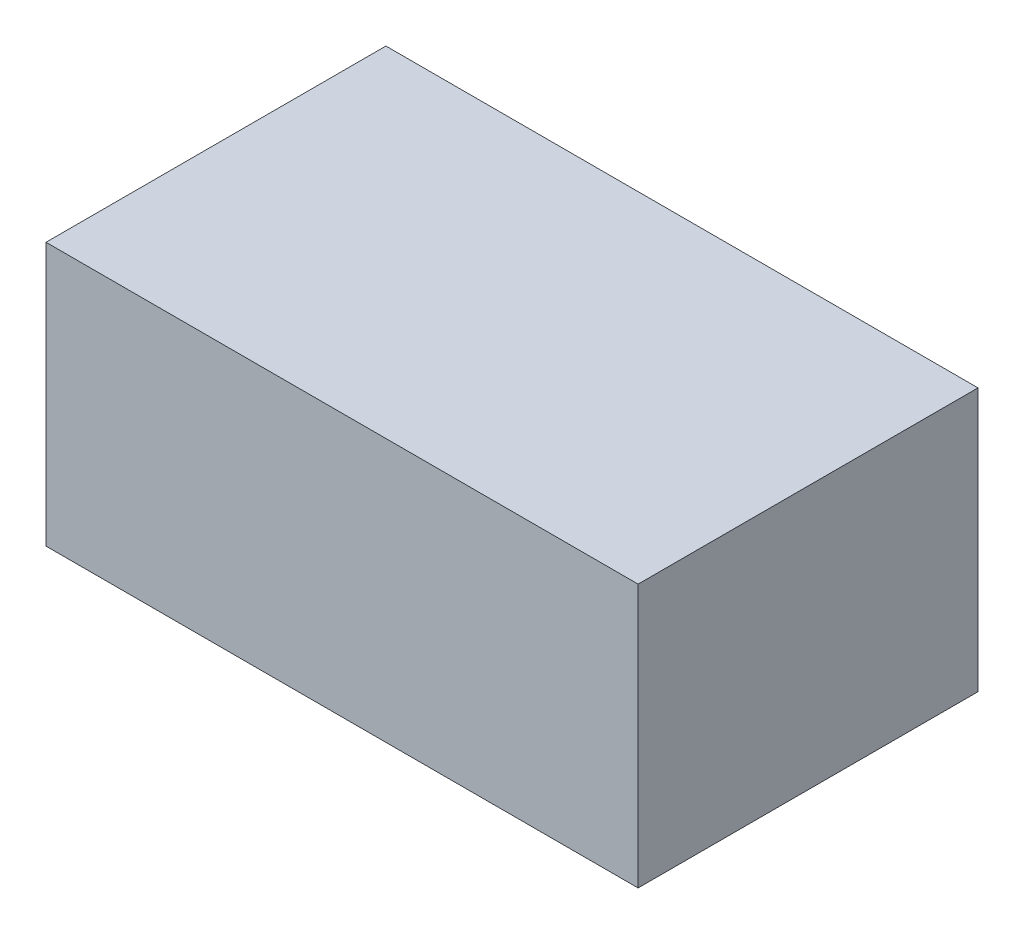
from build123d import *

# Parameters (mm, degrees)
SKETCH1_W           = 685.8
SKETCH1_H           = 393.7
BOSS_EXTRUDE1_DEPTH = 304.8


with BuildPart() as part:
    # Sketch1 → Boss-Extrude1 (new body)
    with BuildSketch(Plane(origin=(0, 0, 0), x_dir=(1, 0, 0), z_dir=(0, 1, 0))):
        Rectangle(SKETCH1_W, SKETCH1_H)
    extrude(amount=BOSS_EXTRUDE1_DEPTH)


solid = part.part
